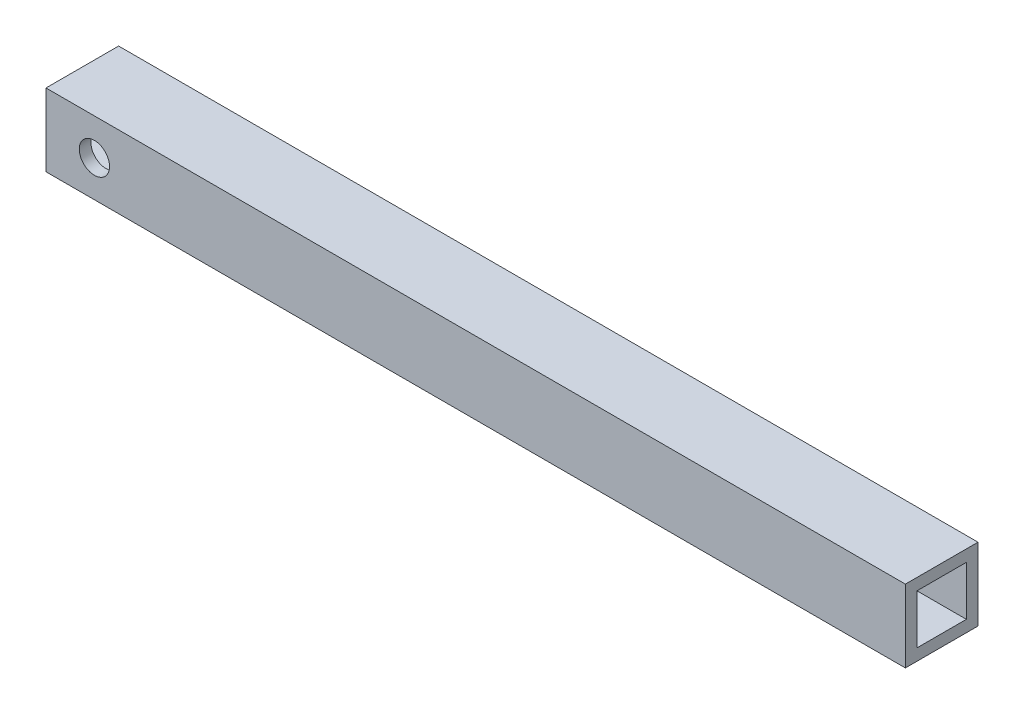
from build123d import *

# Parameters (mm, degrees)
SKETCH1_W           = 19.05
SKETCH1_H           = 19.05
BOSS_EXTRUDE1_DEPTH = 112.7125
SHELL1_T            = -3.048
CUT_EXTRUDE2_REACH  = 116.707
SKETCH8_R           = 3.96875


with BuildPart() as part:
    # Sketch1 → Boss-Extrude1 (new, symmetric)
    with BuildSketch(Plane(origin=(0, 0, 0), x_dir=(0, 0, -1), z_dir=(1, 0, 0))):
        Rectangle(SKETCH1_W, SKETCH1_H)
    extrude(amount=BOSS_EXTRUDE1_DEPTH, both=True)

    # Shell1
    shell1_openings = [part.faces().sort_by_distance(p)[0] for p in [
        (112.7125, 0, 0),
        (-112.7125, 0, 0),
    ]]
    offset(amount=SHELL1_T, openings=shell1_openings, kind=Kind.INTERSECTION)

    # Cut-Extrude2: up to this face of the body (flat: up to its plane)
    cut_extrude2_end = Plane(part.part.faces().sort_by_distance((0, 0, 9.525))[0])
    # Sketch8 → Cut-Extrude2 (cut, up to the picked face)
    with BuildSketch(Plane(origin=(0, 0, -9.525), x_dir=(-1, 0, 0), z_dir=(0, 0, -1)), mode=Mode.PRIVATE) as cut_extrude2_sk1:
        with Locations(Location((100.0125, 0, 0), (0, 0, 90))):
            Circle(SKETCH8_R)
    cut_extrude2_tool1 = split(extrude(cut_extrude2_sk1.sketch, amount=-CUT_EXTRUDE2_REACH, mode=Mode.PRIVATE), bisect_by=cut_extrude2_end, keep=Keep.BOTH, mode=Mode.PRIVATE)
    add(cut_extrude2_tool1.solids().sort_by(Axis((-100.0125, 0, -9.525), (0, 0, 1)))[0], mode=Mode.SUBTRACT)


solid = part.part
